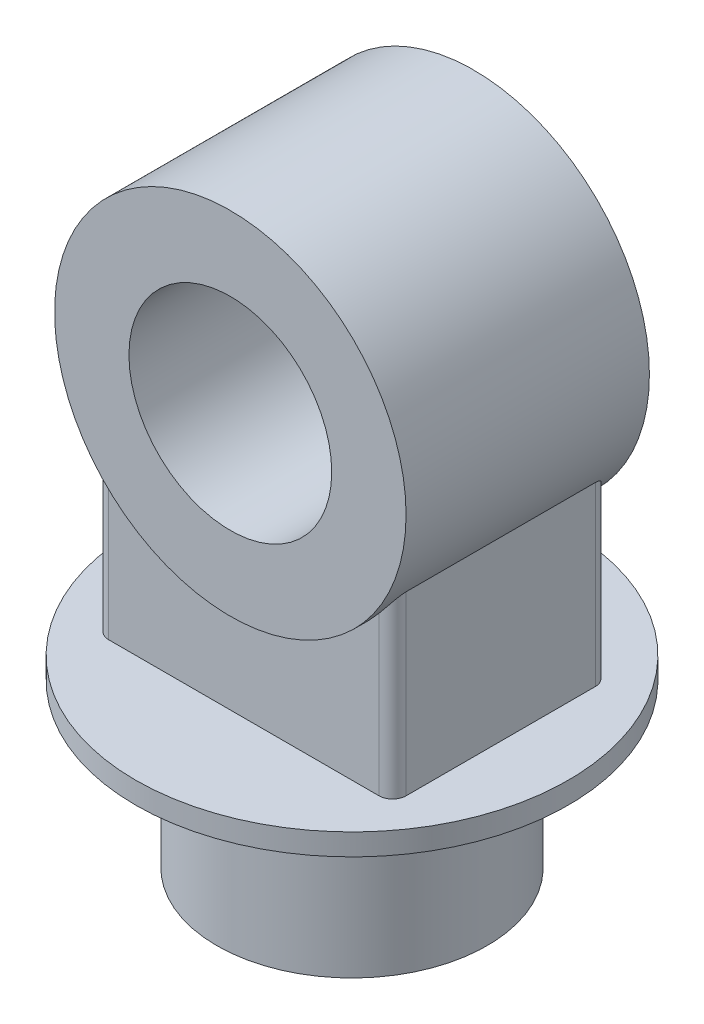
from build123d import *

# Parameters (mm, degrees)
SKETCH1_R                = 2540
BOSS_EXTRUDE1_DEPTH      = 3048
SKETCH2_R                = 4064
BOSS_EXTRUDE2_DEPTH      = 406.4
SKETCH3_R                = 3302
SKETCH3_R_2              = 1905
BOSS_EXTRUDE3_DEPTH      = 2286
BOSS_EXTRUDE4_REACH      = 10165.175
BOSS_EXTRUDE4_END_RADIUS = 3302
SKETCH4_W                = 5588
SKETCH4_H                = 4064
FILLET1_R                = 254


with BuildPart() as part:
    # Sketch1 → Boss-Extrude1 (new body)
    with BuildSketch(Plane(origin=(0, 0, 0), x_dir=(1, 0, 0), z_dir=(0, 1, 0))):
        with Locations(Location((0, 0, 0), (0, 0, 270))):
            Circle(SKETCH1_R)
    extrude(amount=BOSS_EXTRUDE1_DEPTH)

    # Sketch2 → Boss-Extrude2 (add)
    with BuildSketch(Plane(origin=(0, 3048, 0), x_dir=(1, 0, 0), z_dir=(0, 1, 0))):
        with Locations(Location((0, 0, 0), (0, 0, 270))):
            Circle(SKETCH2_R)
    extrude(amount=BOSS_EXTRUDE2_DEPTH)



with BuildPart() as body_2:
    # Sketch3 → Boss-Extrude3 (new, symmetric)
    with BuildSketch(Plane.XY):
        with Locations((0, 8534.4)):
            Circle(SKETCH3_R)
        with Locations((0, 8534.4)):
            Circle(SKETCH3_R_2, mode=Mode.SUBTRACT)
    extrude(amount=BOSS_EXTRUDE3_DEPTH, both=True)


with BuildPart() as part_1:
    add(part.part)

    add(body_2.part)  # Boss-Extrude4 merges body 2
    # Boss-Extrude4: up to this cylinder (the profile starts outside it)
    boss_extrude4_end = Plane(origin=(0, 8534.4, 0), z_dir=(0, 0, -1)) * Cylinder(BOSS_EXTRUDE4_END_RADIUS, 26935.35, mode=Mode.PRIVATE)
    # Sketch4 → Boss-Extrude4 (add, up to the surface)
    with BuildSketch(Plane(origin=(0, 3454.4, 0), x_dir=(1, 0, 0), z_dir=(0, 1, 0)), mode=Mode.PRIVATE) as boss_extrude4_sk1:
        Rectangle(SKETCH4_W, SKETCH4_H)
    boss_extrude4_tool1 = extrude(boss_extrude4_sk1.sketch, amount=BOSS_EXTRUDE4_REACH, mode=Mode.PRIVATE) - boss_extrude4_end
    add(boss_extrude4_tool1.solids().sort_by_distance((0, 3454.4, 0))[0])

    # Fillet1
    fillet1_edges = [part_1.edges().sort_by_distance(p)[0] for p in [
        (-2794, 5114.518189755, 2032),
        (-2794, 5114.518189755, -2032),
        (2794, 5114.518189755, 2032),
        (2794, 5114.518189755, -2032),
    ]]
    fillet(fillet1_edges, radius=FILLET1_R)


solid = part_1.part
